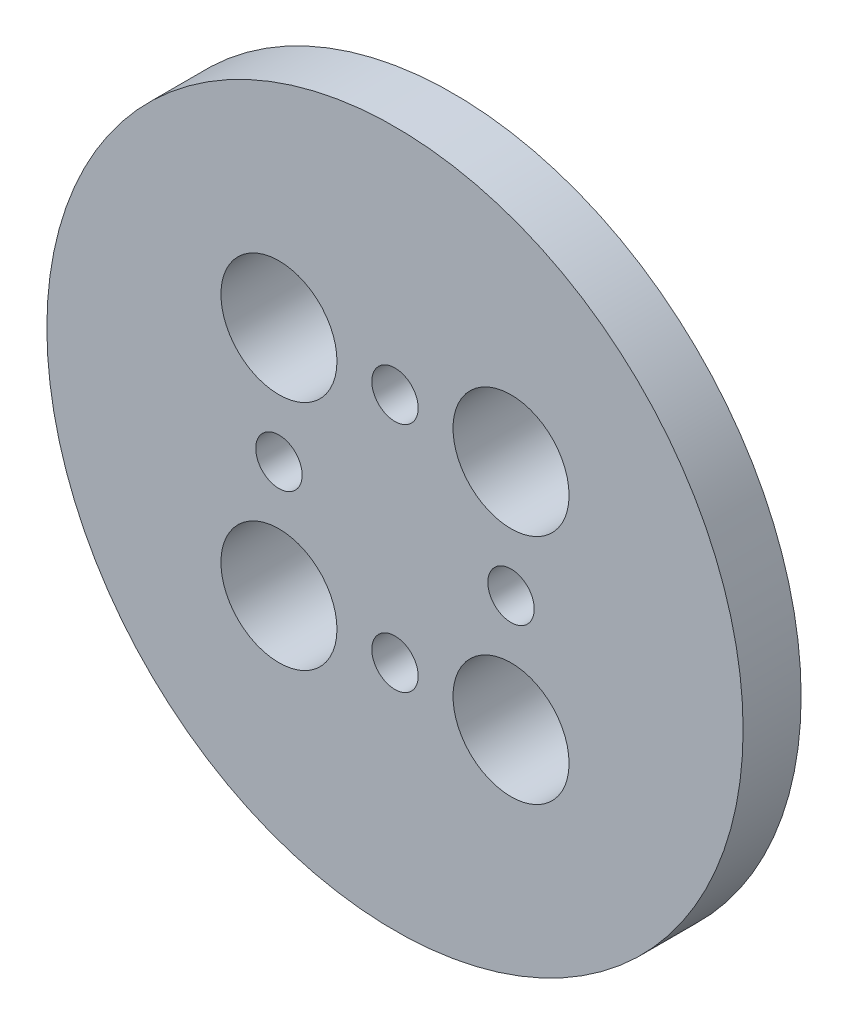
from build123d import *

# Parameters (mm, degrees)
SKETCH1_R              = 15
BODY_DEPTH             = 5
SKETCH2_R              = 15
SKETCH2_R_2            = 10
SLEW_BEARING_LIP_DEPTH = 2.5
SKETCH3_R              = 2.5
CUT_EXTRUDE2_DEPTH     = 22.794494718
SKETCH4_R              = 1
CUT_EXTRUDE3_DEPTH     = 22.794494718


with BuildPart() as part:
    # Sketch1 → body (new body)
    with BuildSketch(Plane.XY):
        Circle(SKETCH1_R)
    extrude(amount=BODY_DEPTH)

    # Sketch2 → slew bearing lip (cut)
    with BuildSketch(Plane(origin=(0, 0, 0), x_dir=(-1, 0, 0), z_dir=(0, 0, -1))):
        Circle(SKETCH2_R)
        Circle(SKETCH2_R_2, mode=Mode.SUBTRACT)
    extrude(amount=-SLEW_BEARING_LIP_DEPTH, mode=Mode.SUBTRACT)

    # Sketch3 → Cut-Extrude2 (cut, through all)
    with BuildSketch(Plane.XY.offset(5)):
        with Locations((-5, 5)):
            Circle(SKETCH3_R)
        with Locations((5, 5)):
            Circle(SKETCH3_R)
        with Locations((5, -5)):
            Circle(SKETCH3_R)
        with Locations((-5, -5)):
            Circle(SKETCH3_R)
    extrude(amount=-CUT_EXTRUDE2_DEPTH, mode=Mode.SUBTRACT)

    # Sketch4 → Cut-Extrude3 (cut, through all)
    with BuildSketch(Plane.XY.offset(5)):
        with Locations((0, 5)):
            Circle(SKETCH4_R)
        with Locations((5, 0)):
            Circle(SKETCH4_R)
        with Locations((0, -5)):
            Circle(SKETCH4_R)
        with Locations((-5, 0)):
            Circle(SKETCH4_R)
    extrude(amount=-CUT_EXTRUDE3_DEPTH, mode=Mode.SUBTRACT)


solid = part.part
